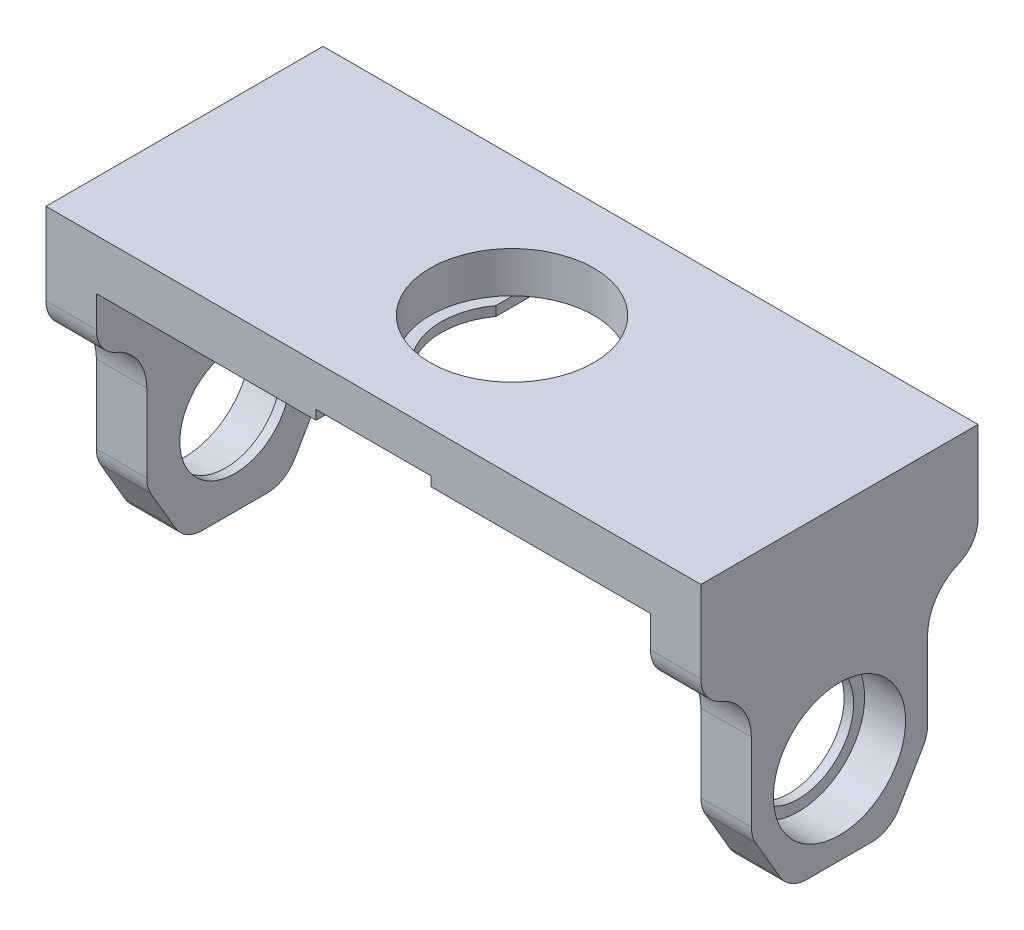
from build123d import *

# Parameters (mm, degrees)
BOSS_EXTRUDE1_DEPTH        = 44
F_21_0_21_DIAMETER_HOLE1_D = 21
F_26_0_26_DIAMETER_HOLE1_D = 26
BOSS_EXTRUDE2_START        = -1.5
SKETCH9_R                  = 10.5
SKETCH9_R_2                = 8.75
BOSS_EXTRUDE2_DEPTH        = 1.5
BOSS_EXTRUDE3_START        = 88
SKETCH9_2_R                = 10.5
SKETCH9_2_R_2              = 8.75
BOSS_EXTRUDE3_DEPTH        = 1.5
SKETCH16_R                 = 13
SKETCH16_R_2               = 11.25
BOSS_EXTRUDE4_DEPTH        = 1.5
SKETCH17_W                 = 18.25
SKETCH17_H                 = 1.5
CUT_EXTRUDE1_DEPTH         = 80.504716841
CUT_EXTRUDE3_DEPTH         = 121.137421314
FILLET3_R                  = 5


with BuildPart() as part:
    # Sketch1 → Boss-Extrude1 (new body)
    with BuildSketch(Plane.XY):
        Polygon((44, 0), (-44, 0), (-44, -41), (-52, -41), (-52, 8), (52, 8), (52, -41), (44, -41), align=None)
    extrude(amount=BOSS_EXTRUDE1_DEPTH)

    # Ø21.0 (21) Diameter Hole1 (through all)
    with Locations(Plane.ZY.offset(52)):
        with Locations((22, -27)):
            Hole(F_21_0_21_DIAMETER_HOLE1_D / 2)

    # Ø26.0 (26) Diameter Hole1 (through all)
    with Locations(Plane(origin=(0, 8, 0), x_dir=(1, 0, 0), z_dir=(0, 1, 0))):
        with Locations((0, -22)):
            Hole(F_26_0_26_DIAMETER_HOLE1_D / 2)

    # Sketch9 → Boss-Extrude2 (add)
    with BuildSketch(Plane.ZY.offset(-44).offset(BOSS_EXTRUDE2_START)):
        with Locations((22, -27)):
            Circle(SKETCH9_R)
        with Locations((22, -27)):
            Circle(SKETCH9_R_2, mode=Mode.SUBTRACT)
    extrude(amount=BOSS_EXTRUDE2_DEPTH)

    # Sketch9<2> → Boss-Extrude3 (add)
    with BuildSketch(Plane.ZY.offset(-44).offset(BOSS_EXTRUDE3_START)):
        with Locations((22, -27)):
            Circle(SKETCH9_2_R)
        with Locations((22, -27)):
            Circle(SKETCH9_2_R_2, mode=Mode.SUBTRACT)
    extrude(amount=BOSS_EXTRUDE3_DEPTH)

    # Sketch16 → Boss-Extrude4 (add)
    with BuildSketch(Plane(origin=(0, 0, 0), x_dir=(1, 0, 0), z_dir=(0, 1, 0))):
        with Locations(Location((0, -22, 0), (0, 0, 270))):
            Circle(SKETCH16_R)
        with Locations(Location((0, -22, 0), (0, 0, 270))):
            Circle(SKETCH16_R_2, mode=Mode.SUBTRACT)
    extrude(amount=BOSS_EXTRUDE4_DEPTH)

    # Sketch17 → Cut-Extrude1 (cut, through all)
    with BuildSketch(Plane.XY.offset(44)):
        with Locations((0, 0.75)):
            Rectangle(SKETCH17_W, SKETCH17_H)
    extrude(amount=-CUT_EXTRUDE1_DEPTH, mode=Mode.SUBTRACT)

    # Sketch19 → Cut-Extrude3 (cut, through all)
    with BuildSketch(Plane.ZY.offset(52)):
        with BuildLine():
            ThreePointArc((0, -25), (2.087839834, -24.722753708), (4.030968204, -23.910231207))
            Line((4.030968204, -23.910231207), (0, -17))
            Line((0, -17), (0, -25))
        make_face()
        with BuildLine():
            Line((0, -17), (4.030968204, -23.910231207))
            ThreePointArc((4.030968204, -23.910231207), (6.937137221, -20.984485812), (8, -17))
            ThreePointArc((8, -17), (5.656854249, -11.343145751), (0, -9))
            Line((0, -9), (0, -17))
        make_face()
        with BuildLine():
            Line((14, -41), (8, -30.714285714))
            Line((8, -30.714285714), (4.030968204, -23.910231207))
            ThreePointArc((4.030968204, -23.910231207), (2.087839834, -24.722753708), (0, -25))
            Line((0, -25), (0, -41))
            Line((0, -41), (14, -41))
        make_face()
        with BuildLine():
            Line((4.030968204, -23.910231207), (8, -30.714285714))
            Line((8, -30.714285714), (8, -17))
            ThreePointArc((8, -17), (6.937137221, -20.984485812), (4.030968204, -23.910231207))
        make_face()
        with BuildLine():
            Line((36, -17), (36, -30.714285714))
            Line((36, -30.714285714), (39.969031796, -23.910231207))
            ThreePointArc((39.969031796, -23.910231207), (37.062862779, -20.984485812), (36, -17))
        make_face()
        with BuildLine():
            ThreePointArc((39.969031796, -23.910231207), (41.912160166, -24.722753708), (44, -25))
            Line((44, -25), (44, -17))
            Line((44, -17), (39.969031796, -23.910231207))
        make_face()
        with BuildLine():
            ThreePointArc((44, -9), (38.343145751, -11.343145751), (36, -17))
            ThreePointArc((36, -17), (37.062862779, -20.984485812), (39.969031796, -23.910231207))
            Line((39.969031796, -23.910231207), (44, -17))
            Line((44, -17), (44, -9))
        make_face()
        with BuildLine():
            Line((36, -30.714285714), (30, -41))
            Line((30, -41), (44, -41))
            Line((44, -41), (44, -25))
            ThreePointArc((44, -25), (41.912160166, -24.722753708), (39.969031796, -23.910231207))
            Line((39.969031796, -23.910231207), (36, -30.714285714))
        make_face()
    extrude(amount=-CUT_EXTRUDE3_DEPTH, mode=Mode.SUBTRACT)

    # Fillet3
    fillet3_edges = [part.edges().sort_by_distance(p)[0] for p in [
        (48, -9, 0),
        (-48, -9, 0),
        (-48, -9, 44),
        (48, -9, 44),
        (-48, -30.714285714, 36),
        (48, -30.714285714, 36),
        (-48, -41, 30),
        (48, -41, 30),
        (-48, -30.714285714, 8),
        (48, -30.714285714, 8),
        (-48, -41, 14),
        (48, -41, 14),
    ]]
    fillet(fillet3_edges, radius=FILLET3_R)


solid = part.part
